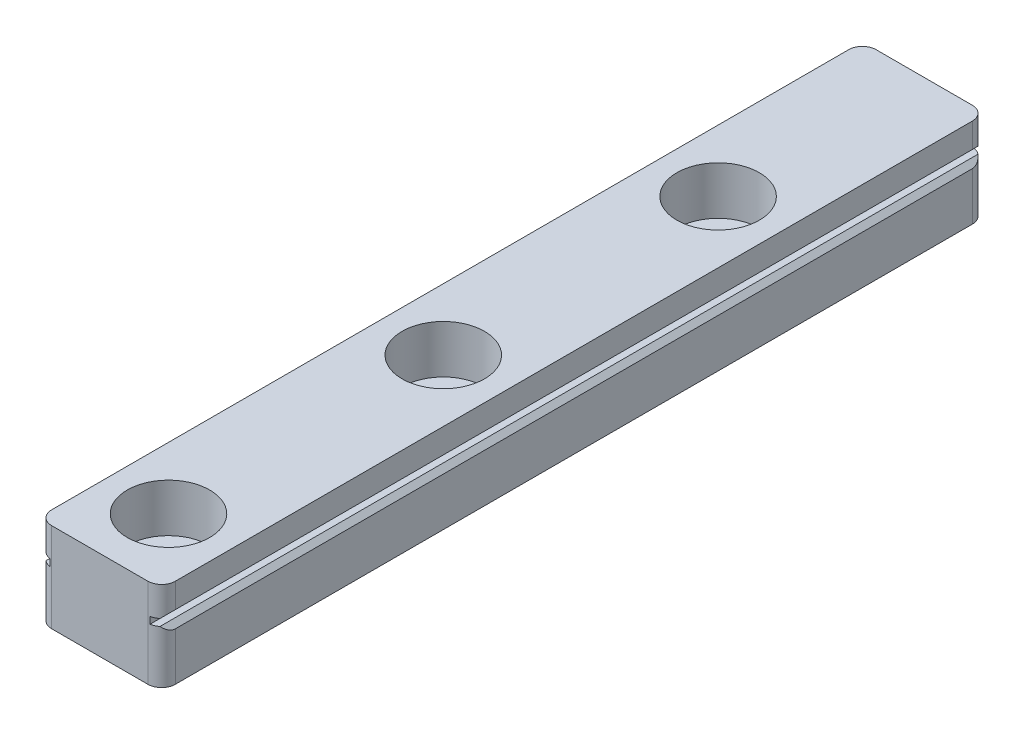
from build123d import *

# Parameters (mm, degrees)
EXTRUDE_2_DEPTH     = 60
SKETCH_3_R          = 3
CUT_EXTRUDE_1_DEPTH = 3.5
SKETCH_4_R          = 1.75
CUT_EXTRUDE_2_DEPTH = 3
FILLET_1_R          = 1


with BuildPart() as part:
    # 草图2 → 凸台-拉伸2 (new body)
    with BuildSketch(Plane.XY):
        Polygon((0, 0), (9, 0), (9, 3.5), (8.646446609, 3.853553391), (8.146446609, 3.853553391), (8.146446609, 4.353553391), (8.646446609, 4.353553391), (9, 4.707106781), (9, 6.5), (0, 6.5), (0, 4.707106781), (0.353553391, 4.353553391), (0.853553391, 4.353553391), (0.853553391, 3.853553391), (0.353553391, 3.853553391), (0, 3.5), align=None)
    extrude(amount=-EXTRUDE_2_DEPTH)

    # 草图3 → 切除-拉伸1 (cut)
    with BuildSketch(Plane(origin=(0, 6.5, 0), x_dir=(1, 0, 0), z_dir=(0, 1, 0))):
        with Locations(Location((4.5, 5, 0), (0, 0, 270))):
            Circle(SKETCH_3_R)
        with Locations(Location((4.5, 25, 0), (0, 0, 270))):
            Circle(SKETCH_3_R)
        with Locations(Location((4.5, 45, 0), (0, 0, 270))):
            Circle(SKETCH_3_R)
        with Locations((4.5, 65)):
            Circle(SKETCH_3_R)
        with Locations((4.5, 85)):
            Circle(SKETCH_3_R)
        with Locations((4.5, 105)):
            Circle(SKETCH_3_R)
        with Locations((4.5, 125)):
            Circle(SKETCH_3_R)
        with Locations((4.5, 145)):
            Circle(SKETCH_3_R)
        with Locations((4.5, 165)):
            Circle(SKETCH_3_R)
        with Locations((4.5, 185)):
            Circle(SKETCH_3_R)
        with Locations((4.5, 205)):
            Circle(SKETCH_3_R)
        with Locations((4.5, 225)):
            Circle(SKETCH_3_R)
    extrude(amount=-CUT_EXTRUDE_1_DEPTH, mode=Mode.SUBTRACT)

    # 草图4 → 切除-拉伸2 (cut)
    with BuildSketch(Plane(origin=(0, 3, 0), x_dir=(1, 0, 0), z_dir=(0, 1, 0))):
        with Locations(Location((4.5, 5, 0), (0, 0, 270))):
            Circle(SKETCH_4_R)
        with Locations(Location((4.5, 25, 0), (0, 0, 270))):
            Circle(SKETCH_4_R)
        with Locations(Location((4.5, 45, 0), (0, 0, 270))):
            Circle(SKETCH_4_R)
        with Locations((4.5, 65)):
            Circle(SKETCH_4_R)
        with Locations((4.5, 85)):
            Circle(SKETCH_4_R)
        with Locations((4.5, 105)):
            Circle(SKETCH_4_R)
        with Locations((4.5, 125)):
            Circle(SKETCH_4_R)
        with Locations((4.5, 145)):
            Circle(SKETCH_4_R)
        with Locations((4.5, 165)):
            Circle(SKETCH_4_R)
        with Locations((4.5, 185)):
            Circle(SKETCH_4_R)
        with Locations((4.5, 205)):
            Circle(SKETCH_4_R)
        with Locations((4.5, 225)):
            Circle(SKETCH_4_R)
    extrude(amount=-CUT_EXTRUDE_2_DEPTH, mode=Mode.SUBTRACT)

    # 圆角1
    fillet_1_edges = [part.edges().sort_by_distance(p)[0] for p in [
        (9, 1.75, -60),
        (0, 1.75, -60),
        (9, 1.75, 0),
        (0, 1.75, 0),
    ]]
    fillet(fillet_1_edges, radius=FILLET_1_R)


solid = part.part
